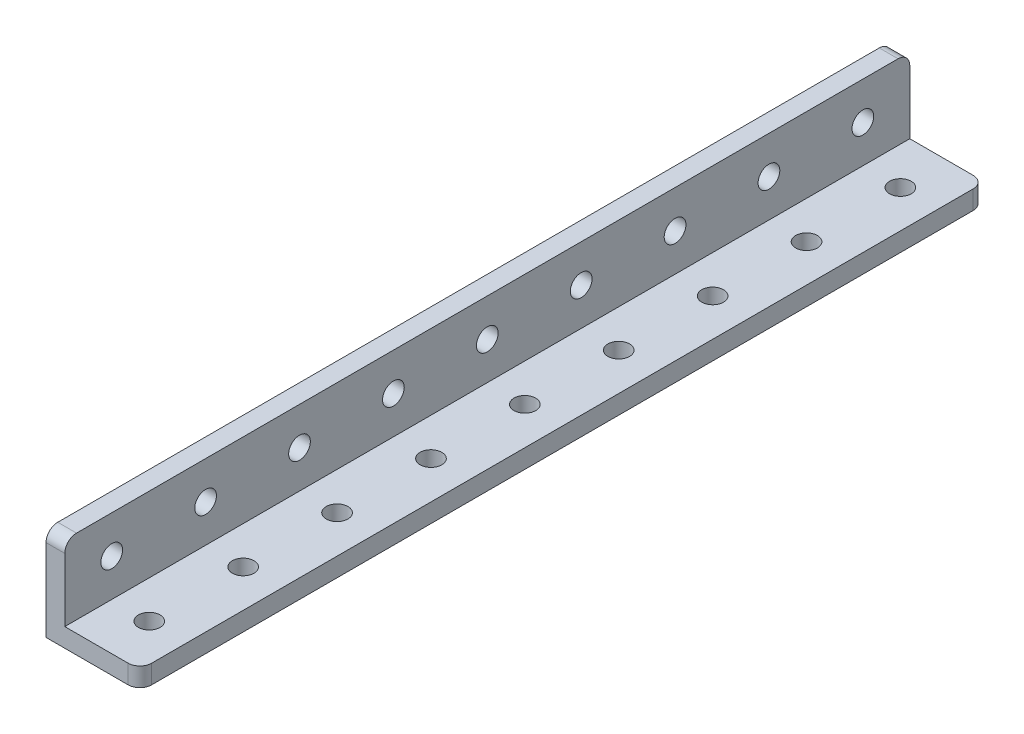
from build123d import *

# Parameters (mm, degrees)
BOSS_EXTRUDE1_DEPTH = 144
SKETCH2_R           = 1.85
CUT_EXTRUDE1_DEPTH  = 146.766937266
SKETCH3_R           = 1.85
CUT_EXTRUDE2_DEPTH  = 146.766937266
FILLET1_R           = 2


with BuildPart() as part:
    # Sketch1 → Boss-Extrude1 (new body)
    with BuildSketch(Plane.XY):
        Polygon((0, 16), (0, 0), (16, 0), (16, 3.2), (3.2, 3.2), (3.2, 16), align=None)
    extrude(amount=-BOSS_EXTRUDE1_DEPTH)

    # Sketch2 → Cut-Extrude1 (cut, through all)
    with BuildSketch(Plane.ZY):
        with Locations(Location((-88, 9.6, 0), (0, 0, 180))):
            Circle(SKETCH2_R)
        with Locations(Location((-104, 9.6, 0), (0, 0, 180))):
            Circle(SKETCH2_R)
        with Locations(Location((-120, 9.6, 0), (0, 0, 180))):
            Circle(SKETCH2_R)
        with Locations(Location((-136, 9.6, 0), (0, 0, 180))):
            Circle(SKETCH2_R)
        with Locations(Location((-8, 9.6, 0), (0, 0, 270))):
            Circle(SKETCH2_R)
        with Locations(Location((-24, 9.6, 0), (0, 0, 270))):
            Circle(SKETCH2_R)
        with Locations(Location((-40, 9.6, 0), (0, 0, 270))):
            Circle(SKETCH2_R)
        with Locations(Location((-56, 9.6, 0), (0, 0, 270))):
            Circle(SKETCH2_R)
        with Locations(Location((-72, 9.6, 0), (0, 0, 270))):
            Circle(SKETCH2_R)
    extrude(amount=-CUT_EXTRUDE1_DEPTH, mode=Mode.SUBTRACT)

    # Sketch3 → Cut-Extrude2 (cut, through all)
    with BuildSketch(Plane.XZ):
        with Locations(Location((9.6, -88, 0), (0, 0, 180))):
            Circle(SKETCH3_R)
        with Locations(Location((9.6, -104, 0), (0, 0, 180))):
            Circle(SKETCH3_R)
        with Locations(Location((9.6, -120, 0), (0, 0, 180))):
            Circle(SKETCH3_R)
        with Locations(Location((9.6, -136, 0), (0, 0, 180))):
            Circle(SKETCH3_R)
        with Locations(Location((9.6, -8, 0), (0, 0, 270))):
            Circle(SKETCH3_R)
        with Locations(Location((9.6, -24, 0), (0, 0, 270))):
            Circle(SKETCH3_R)
        with Locations(Location((9.6, -40, 0), (0, 0, 270))):
            Circle(SKETCH3_R)
        with Locations(Location((9.6, -56, 0), (0, 0, 270))):
            Circle(SKETCH3_R)
        with Locations(Location((9.6, -72, 0), (0, 0, 270))):
            Circle(SKETCH3_R)
    extrude(amount=-CUT_EXTRUDE2_DEPTH, mode=Mode.SUBTRACT)

    # Fillet1
    fillet1_edges = [part.edges().sort_by_distance(p)[0] for p in [
        (16, 1.6, -144),
        (1.6, 16, -144),
        (16, 1.6, 0),
        (1.6, 16, 0),
    ]]
    fillet(fillet1_edges, radius=FILLET1_R)


solid = part.part
